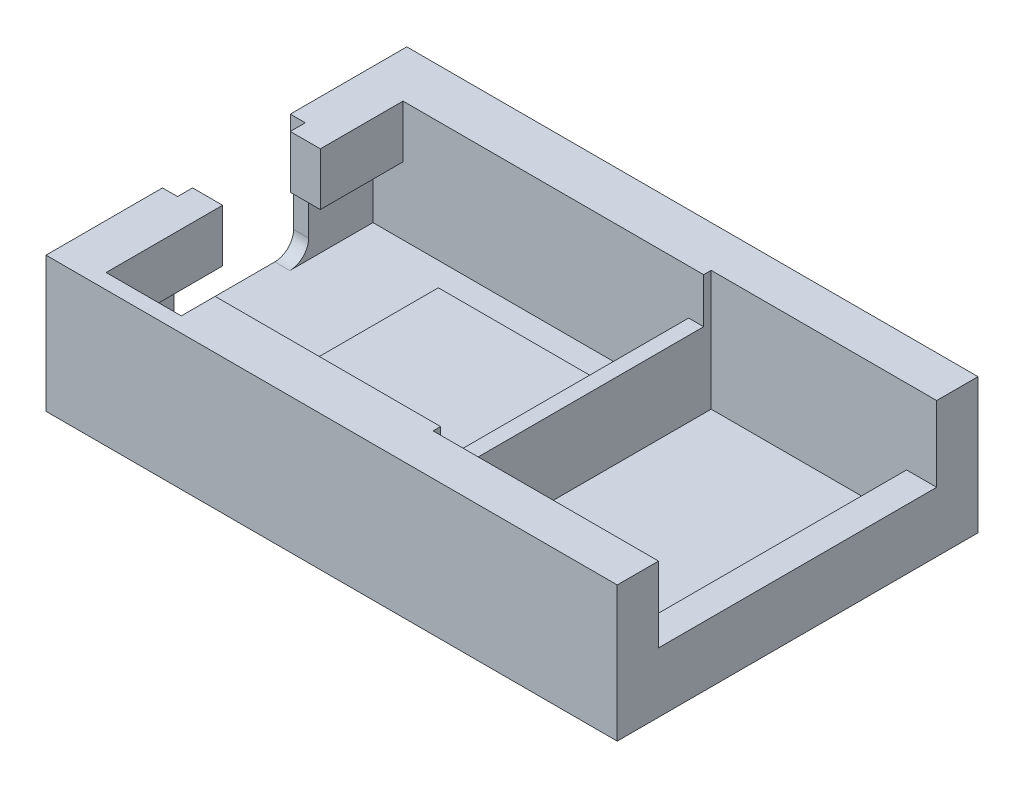
from build123d import *

# Parameters (mm, degrees)
SKETCH1_W           = 40
SKETCH1_H           = 24
BOSS_EXTRUDE1_DEPTH = 1
SKETCH2_W           = 40
SKETCH2_H           = 24
SKETCH2_W_2         = 21
SKETCH2_H_2         = 17.5
SKETCH2_W_3         = 13
SKETCH2_H_3         = 18.5
BOSS_EXTRUDE3_DEPTH = 8
SKETCH3_W           = 1
SKETCH3_H           = 17.5
CUT_EXTRUDE2_DEPTH  = 3
SKETCH4_W           = 10.24
SKETCH4_H           = 11.92
BOSS_EXTRUDE4_DEPTH = 1.21
CUT_EXTRUDE3_DEPTH  = 2
SKETCH8_W           = 4
SKETCH8_H           = 18.5
CUT_EXTRUDE4_DEPTH  = 5
SKETCH11_W          = 24
SKETCH11_H          = 9
CUT_EXTRUDE5_DEPTH  = 2
SKETCH12_W          = 4
SKETCH12_H          = 3
CUT_EXTRUDE6_DEPTH  = 3
BOSS_EXTRUDE5_DEPTH = 3.5
SKETCH14_W          = 1
SKETCH14_H          = 2.25
CUT_EXTRUDE7_DEPTH  = 3


with BuildPart() as part:
    # Sketch1 → Boss-Extrude1 (new body)
    with BuildSketch(Plane(origin=(0, 0, 0), x_dir=(1, 0, 0), z_dir=(0, 1, 0))):
        with Locations((20, 12)):
            Rectangle(SKETCH1_W, SKETCH1_H)
    extrude(amount=BOSS_EXTRUDE1_DEPTH)

    # Sketch2 → Boss-Extrude3 (add)
    with BuildSketch(Plane(origin=(0, 1, 0), x_dir=(1, 0, 0), z_dir=(0, 1, 0))):
        with Locations((20, 12)):
            Rectangle(SKETCH2_W, SKETCH2_H)
        with Locations((11.5, 12)):
            Rectangle(SKETCH2_W_2, SKETCH2_H_2, mode=Mode.SUBTRACT)
        with Locations((29.5, 12)):
            Rectangle(SKETCH2_W_3, SKETCH2_H_3, mode=Mode.SUBTRACT)
    extrude(amount=BOSS_EXTRUDE3_DEPTH)

    # Sketch3 → Cut-Extrude2 (cut)
    with BuildSketch(Plane(origin=(0, 9, 0), x_dir=(1, 0, 0), z_dir=(0, 1, 0))):
        with Locations((22.5, 12)):
            Rectangle(SKETCH3_W, SKETCH3_H)
    extrude(amount=-CUT_EXTRUDE2_DEPTH, mode=Mode.SUBTRACT)

    # Sketch4 → Boss-Extrude4 (add)
    with BuildSketch(Plane(origin=(0, 1, 0), x_dir=(1, 0, 0), z_dir=(0, 1, 0))):
        with Locations((13.26, 12)):
            Rectangle(SKETCH4_W, SKETCH4_H)
    extrude(amount=BOSS_EXTRUDE4_DEPTH)

    # Sketch5 → Cut-Extrude3 (cut)
    with BuildSketch(Plane(origin=(1, 0, 0), x_dir=(0, 0, -1), z_dir=(1, 0, 0))):
        with BuildLine():
            Line((7.53, 2.25), (7.53, 2.96))
            Line((7.53, 2.96), (7.53, 9))
            Line((7.53, 9), (16.47, 9))
            Line((16.47, 9), (16.47, 2.96))
            Line((16.47, 2.96), (16.47, 2.25))
            ThreePointArc((16.47, 2.25), (16.103883476, 1.366116524), (15.22, 1))
            Line((15.22, 1), (8.78, 1))
            ThreePointArc((8.78, 1), (7.896116524, 1.366116524), (7.53, 2.25))
        make_face()
    extrude(amount=-CUT_EXTRUDE3_DEPTH, mode=Mode.SUBTRACT)

    # Sketch8 → Cut-Extrude4 (cut)
    with BuildSketch(Plane(origin=(0, 9, 0), x_dir=(1, 0, 0), z_dir=(0, 1, 0))):
        with Locations((38, 12)):
            Rectangle(SKETCH8_W, SKETCH8_H)
    extrude(amount=-CUT_EXTRUDE4_DEPTH, mode=Mode.SUBTRACT)

    # Sketch11 → Cut-Extrude5 (cut)
    with BuildSketch(Plane(origin=(40, 0, 0), x_dir=(0, 0, -1), z_dir=(1, 0, 0))):
        with Locations((12, 4.5)):
            Rectangle(SKETCH11_W, SKETCH11_H)
    extrude(amount=-CUT_EXTRUDE5_DEPTH, mode=Mode.SUBTRACT)

    # Sketch12 → Cut-Extrude6 (cut)
    with BuildSketch(Plane(origin=(0, 9, 0), x_dir=(1, 0, 0), z_dir=(0, 1, 0))):
        with Locations((6, 2.5)):
            Rectangle(SKETCH12_W, SKETCH12_H)
    extrude(amount=-CUT_EXTRUDE6_DEPTH, mode=Mode.SUBTRACT)

    # Sketch13 → Boss-Extrude5 (add)
    with BuildSketch(Plane(origin=(0, 9, 0), x_dir=(1, 0, 0), z_dir=(0, 1, 0))):
        Polygon((1, 16.47), (1, 20.75), (3, 20.75), (3, 15.25), (1, 15.25), (1, 16.25), (0, 16.25), (0, 16.47), align=None)
        Polygon((1, 3.25), (3, 3.25), (3, 8.75), (1, 8.75), (1, 7.75), (0, 7.75), (0, 7.53), (1, 7.53), align=None)
    extrude(amount=-BOSS_EXTRUDE5_DEPTH)

    # Sketch14 → Cut-Extrude7 (cut)
    with BuildSketch(Plane(origin=(0, 9, 0), x_dir=(1, 0, 0), z_dir=(0, 1, 0))):
        with Locations((3.5, 2.125)):
            Rectangle(SKETCH14_W, SKETCH14_H)
    extrude(amount=-CUT_EXTRUDE7_DEPTH, mode=Mode.SUBTRACT)


solid = part.part
